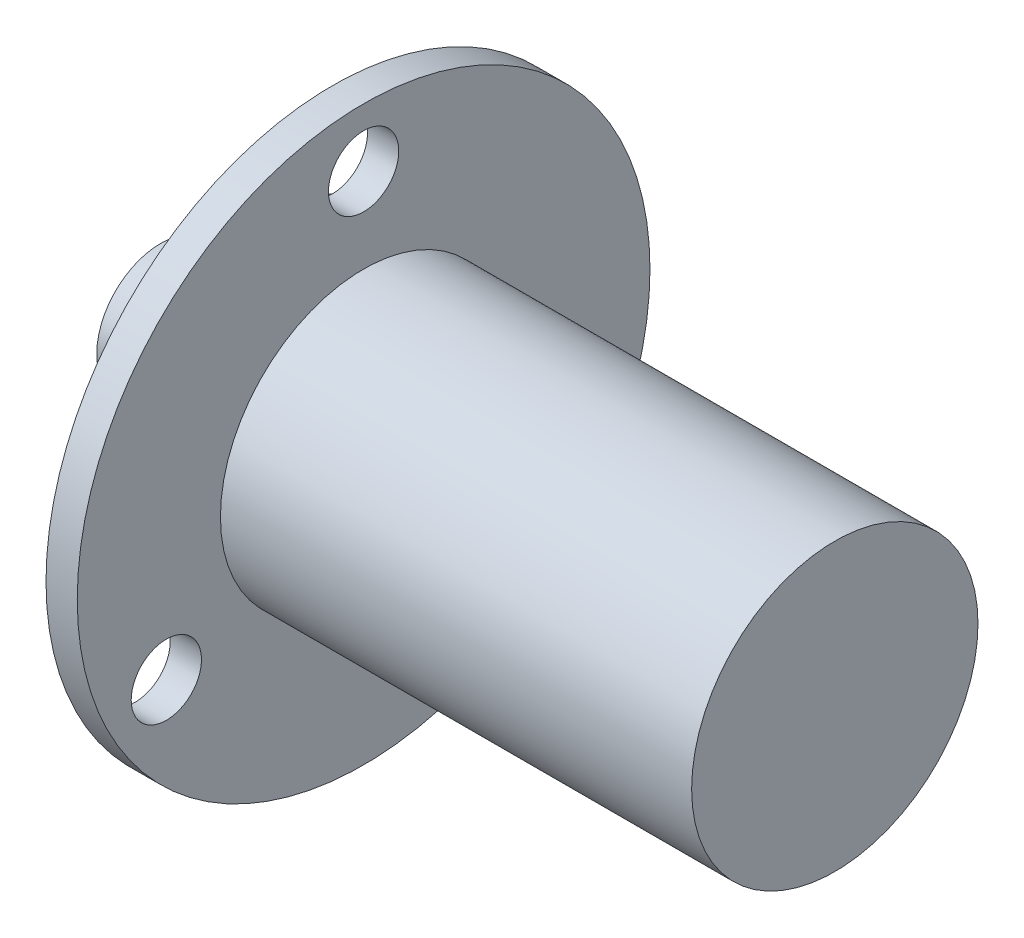
from build123d import *

# Parameters (mm, degrees)
SKETCH_2_R               = 2.7
CUT_EXTRUDE_1_DEPTH      = 50.57781762
PATTERN_CIRCULAR_1_COUNT = 3


with BuildPart() as part:
    # 草图1 → 旋转1 (revolve)
    with BuildSketch(Plane.XY, mode=Mode.PRIVATE) as revolve_1_sk:
        Polygon((0, 0), (0, 4.9), (8.2, 4.9), (8.2, 11), (13.2, 11), (13.2, 22), (15.6, 22), (15.6, 11), (51.8, 11), (51.8, 0), align=None)
    revolve(revolve_1_sk.sketch.rotate(Axis((0, 0, 0), (1, 0, 0)), 90), axis=Axis((0, 0, 0), (1, 0, 0)))

    # 草图2 → 切除-拉伸1 (cut, symmetric)
    with BuildSketch(Plane.ZY.offset(-13.2)):
        with Locations((0, 17.5)):
            Circle(SKETCH_2_R)
    cut_extrude_1 = extrude(amount=CUT_EXTRUDE_1_DEPTH, both=True, mode=Mode.SUBTRACT)

    # 阵列(圆周)1: 切除-拉伸1 ×3 about axis
    pattern_circular_1_axis = Axis((0, 0, 0), (1, 0, 0))
    for i in range(1, PATTERN_CIRCULAR_1_COUNT):
        add(cut_extrude_1.rotate(pattern_circular_1_axis, i * 360 / PATTERN_CIRCULAR_1_COUNT), mode=Mode.SUBTRACT)


solid = part.part
